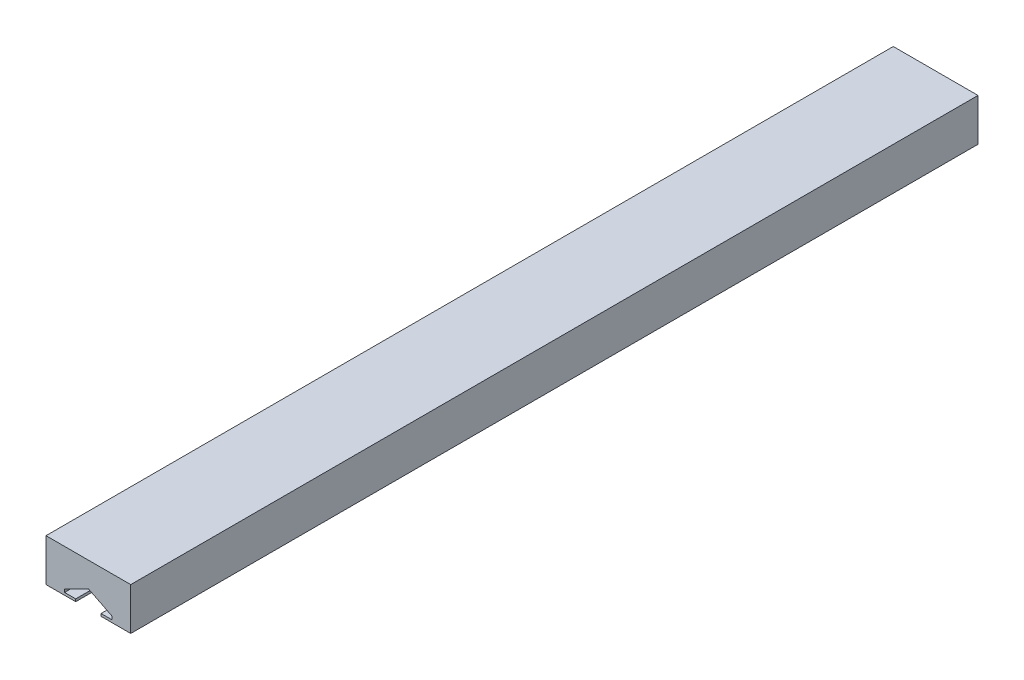
from build123d import *

# Parameters (mm, degrees)
EXTRUDE_1_DEPTH = 200


with BuildPart() as part:
    # 草图1 → 凸台-拉伸1 (new body)
    with BuildSketch(Plane.XY):
        Polygon((10, -5), (2.991173256, -5), (2.991173256, -4.415065752), (5.616135547, -4.415065752), (5.616135547, -3.666827547), (0, -0.858759774), (-5.616135547, -3.666827547), (-5.616135547, -4.415065752), (-2.991173256, -4.415065752), (-2.991173256, -5), (-10, -5), (-10, 5), (10, 5), align=None)
    extrude(amount=EXTRUDE_1_DEPTH)


solid = part.part
